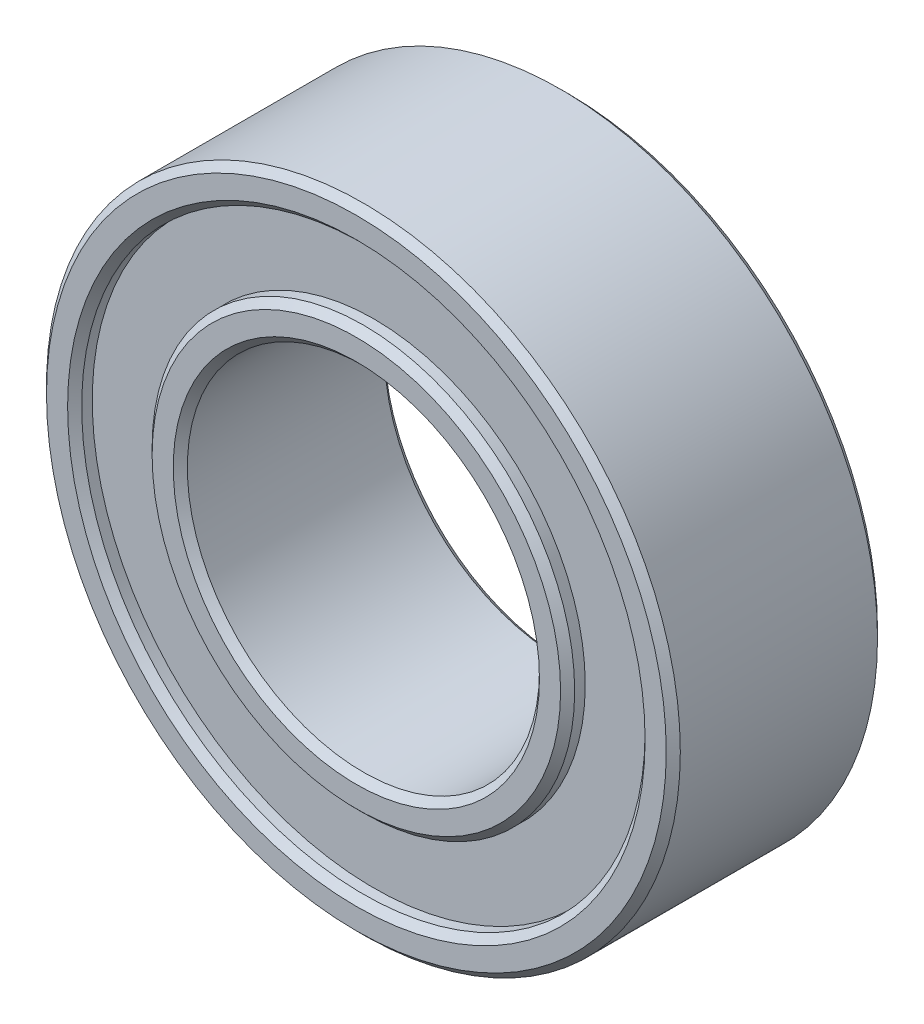
from build123d import *

# Parameters (mm, degrees)
SKETCH1_R           = 4.5
BOSS_EXTRUDE1_DEPTH = 3
SKETCH2_R           = 2.5
CUT_EXTRUDE1_DEPTH  = 8.03562364
SKETCH3_R           = 4
SKETCH3_R_2         = 3
CUT_EXTRUDE3_DEPTH  = 0.25
CUT_EXTRUDE4_START  = -0.25
SKETCH4_R           = 4
SKETCH4_R_2         = 3
CUT_EXTRUDE4_DEPTH  = 0.25
CHAMFER3_SIZE       = 0.1


with BuildPart() as part:
    # Sketch1 → Boss-Extrude1 (new body)
    with BuildSketch(Plane.XY):
        Circle(SKETCH1_R)
    extrude(amount=BOSS_EXTRUDE1_DEPTH)

    # Sketch2 → Cut-Extrude1 (cut, through all)
    with BuildSketch(Plane.XY.offset(3)):
        Circle(SKETCH2_R)
    extrude(amount=-CUT_EXTRUDE1_DEPTH, mode=Mode.SUBTRACT)

    # Sketch3 → Cut-Extrude3 (cut)
    with BuildSketch(Plane.XY.offset(3)):
        Circle(SKETCH3_R)
        Circle(SKETCH3_R_2, mode=Mode.SUBTRACT)
    extrude(amount=-CUT_EXTRUDE3_DEPTH, mode=Mode.SUBTRACT)

    # Sketch4 → Cut-Extrude4 (cut)
    with BuildSketch(Plane(origin=(0, 0, 0), x_dir=(-1, 0, 0), z_dir=(0, 0, -1)).offset(CUT_EXTRUDE4_START)):
        with Locations(Location((0, 0, 0), (0, 0, 180))):
            Circle(SKETCH4_R)
        with Locations(Location((0, 0, 0), (0, 0, 180))):
            Circle(SKETCH4_R_2, mode=Mode.SUBTRACT)
    extrude(amount=CUT_EXTRUDE4_DEPTH, mode=Mode.SUBTRACT)

    # Chamfer3
    chamfer3_edges = [part.edges().sort_by_distance(p)[0] for p in [
        (-4, 0, 3),
        (-3, 0, 3),
        (-4.5, 0, 0),
        (-4, 0, 0),
        (-3, 0, 0),
        (-4.5, 0, 3),
        (-2.5, 0, 0),
        (-2.5, 0, 3),
    ]]
    chamfer(chamfer3_edges, length=CHAMFER3_SIZE)


solid = part.part
